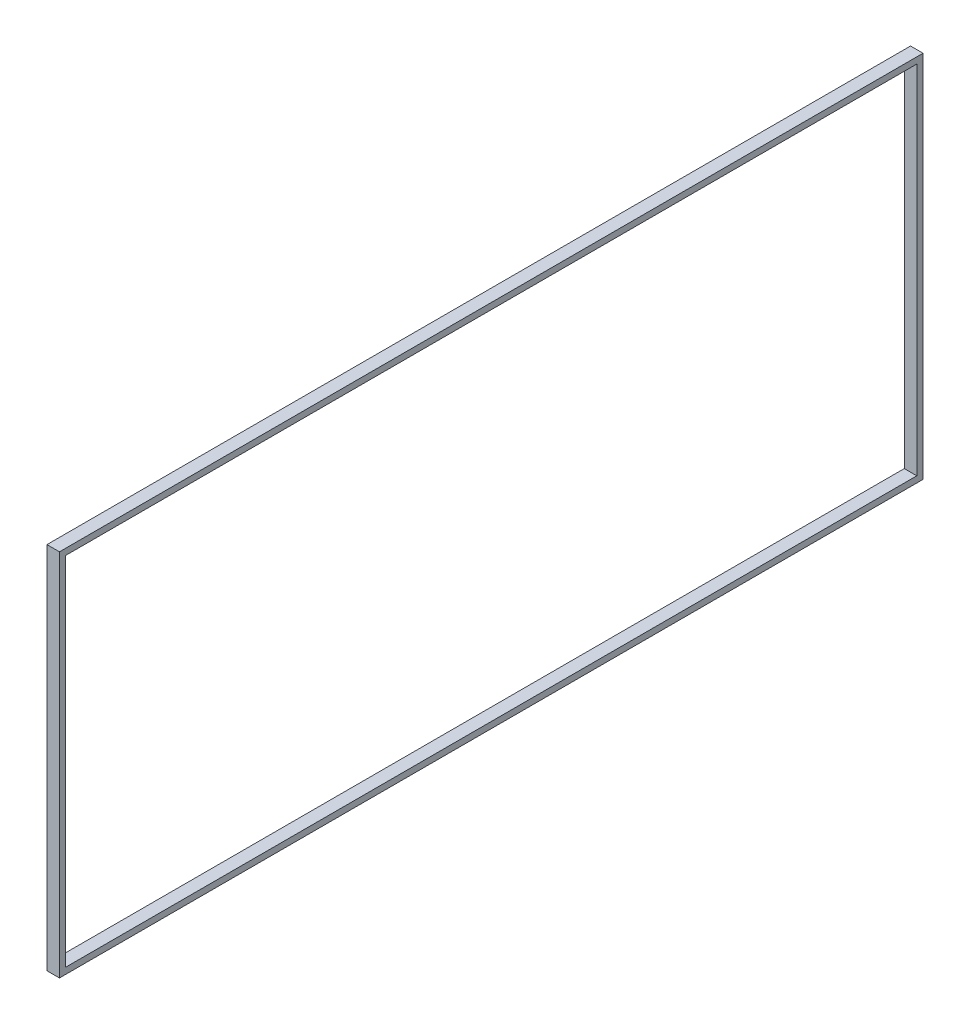
from build123d import *

# Parameters (mm, degrees)
SKETCH1_W           = 6905.40199
SKETCH1_H           = 2951.372621228
SKETCH1_W_2         = 6805.40199
SKETCH1_H_2         = 2851.372621228
BOSS_EXTRUDE1_DEPTH = 100


with BuildPart() as part:
    # Sketch1 → Boss-Extrude1 (new body)
    with BuildSketch(Plane(origin=(1477.78, 0, 0), x_dir=(0, 0, -1), z_dir=(1, 0, 0))):
        with Locations((-132.500995, 503.033219386)):
            Rectangle(SKETCH1_W, SKETCH1_H)
        with Locations((-132.500995, 503.033219386)):
            Rectangle(SKETCH1_W_2, SKETCH1_H_2, mode=Mode.SUBTRACT)
    extrude(amount=-BOSS_EXTRUDE1_DEPTH)


solid = part.part
